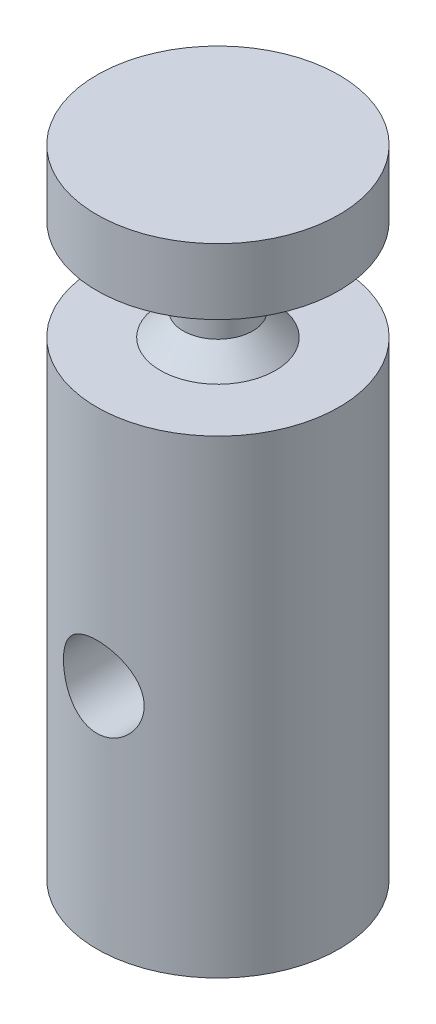
from build123d import *

# Parameters (mm, degrees)
DI_METRO_DE_TALADRO_1_4_0_25_1_D = 6.35


with BuildPart() as part:
    # Croquis1 → Revolución1 (revolve)
    with BuildSketch(Plane.XY, mode=Mode.PRIVATE) as revoluci_n1_sk:
        Polygon((-9.525, 0), (0, 0), (0, 50.038), (-9.525, 50.038), (-9.525, 44.86275), (-4.525, 44.86275), (-2.73, 43.06775), (-2.73, 38.71775), (-4.525, 36.92275), (-9.525, 36.92275), (-9.525, 22.63475), (-9.525, 2), align=None)
    revolve(revoluci_n1_sk.sketch.rotate(Axis((0, 0, 0), (0, 1, 0)), 270), axis=Axis((0, 0, 0), (0, 1, 0)))

    # Diámetro de taladro 1/4 (0.25)1 (through all)
    with Locations(Plane(origin=(0, 17.875, 9.525), x_dir=(1, 0, 0), z_dir=(0, 0, 1))):
        with Locations((0, 0)):
            Hole(DI_METRO_DE_TALADRO_1_4_0_25_1_D / 2)


solid = part.part
